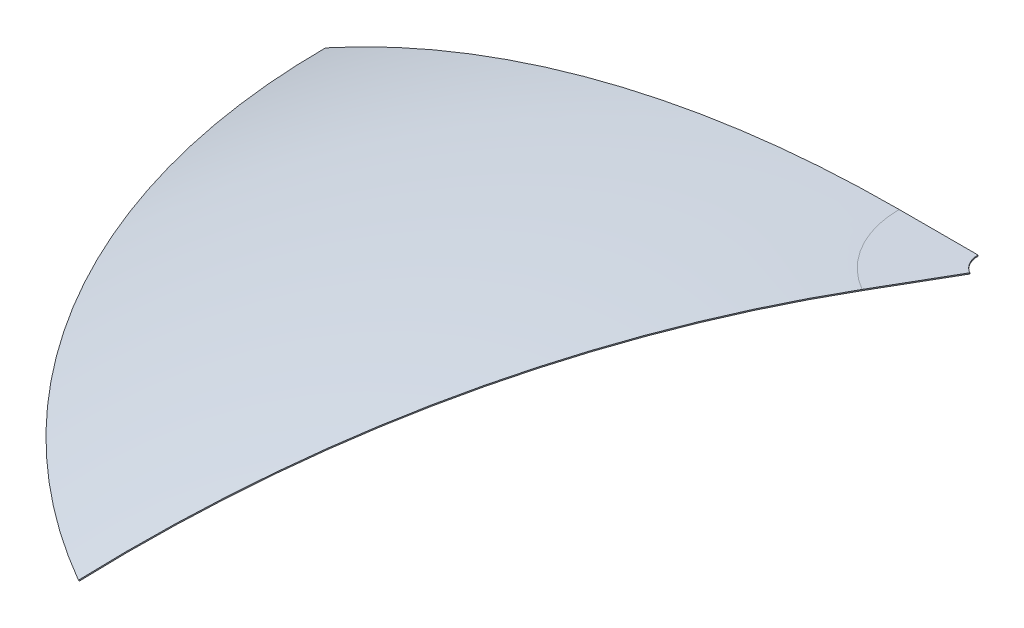
from build123d import *

# Parameters (mm, degrees)
REVOLVE1_ANGLE = 60


with BuildPart() as part:
    # Sketch1 → Revolve1 (revolve)
    with BuildSketch(Plane.XY):
        with BuildLine():
            Line((-45, 1.5), (-10, 1.5))
            Line((-10, 1.5), (-10, 2))
            Line((-10, 2), (-45, 2))
            ThreePointArc((-45, 2), (-45.501418895, 1.999762884), (-46.002837341, 1.999051535))
            ThreePointArc((-46.002837341, 1.999051535), (-176.962949727, -14.686012882), (-299.740246695, -63.211034879))
            Line((-299.740246695, -63.211034879), (-299.5, -63.649534053))
            ThreePointArc((-299.5, -63.649534053), (-176.838494864, -15.170276226), (-46.001891561, 1.49905243))
            ThreePointArc((-46.001891561, 1.49905243), (-45.500946005, 1.499763107), (-45, 1.5))
        make_face()
    revolve(axis=Axis((0, -998.5, 0), (0, 1, 0)), revolution_arc=REVOLVE1_ANGLE)


solid = part.part
